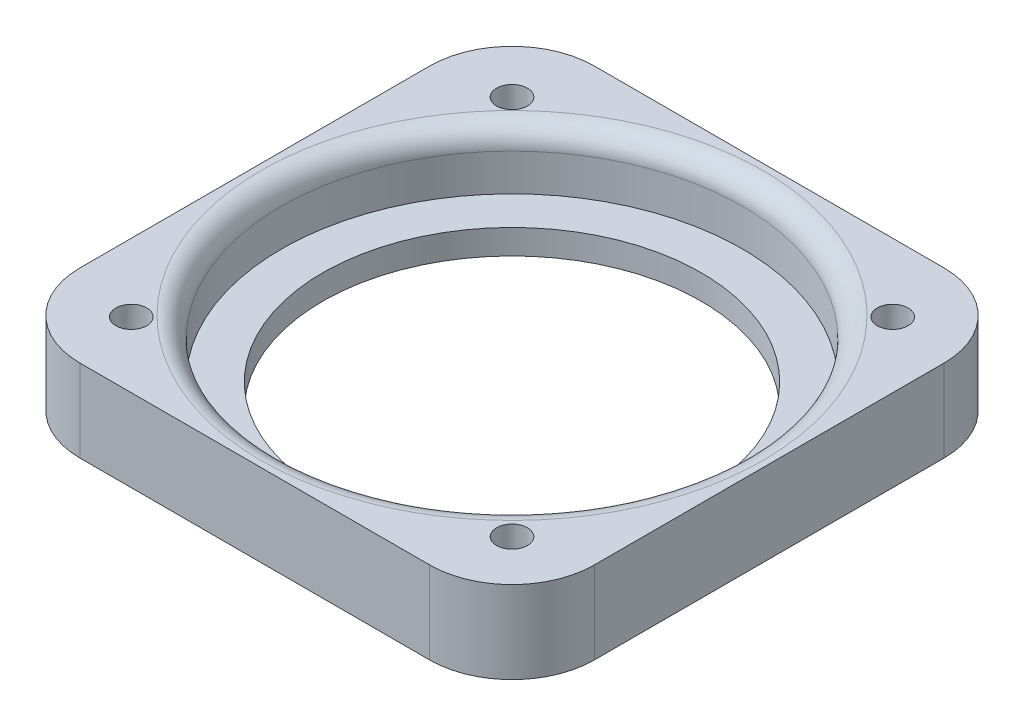
from build123d import *

# Parameters (mm, degrees)
SKETCH_1_R               = 25
EXTRUDE_1_DEPTH          = 8
SKETCH_2_R               = 22.4
CUT_EXTRUDE_1_DEPTH      = 5.6
SKETCH_3_R               = 18.4
CUT_EXTRUDE_2_DEPTH      = 12.5
EXTRUDE_2_DEPTH          = 8
FILLET_1_R               = 8
CUT_EXTRUDE_START        = -15
SKETCH_5_R               = 1.5
CUT_EXTRUDE_3_DEPTH      = 15
FILLET_2_R               = 2
SKETCH_6_R               = 3.5
CUT_EXTRUDE_4_DEPTH      = 2
PATTERN_CIRCULAR_1_COUNT = 4


with BuildPart() as part:
    # 草图1 → 凸台-拉伸1 (new body)
    with BuildSketch(Plane(origin=(0, 0, 0), x_dir=(1, 0, 0), z_dir=(0, 1, 0))):
        with Locations(Location((0, 0, 0), (0, 0, 270))):
            Circle(SKETCH_1_R)
    extrude(amount=EXTRUDE_1_DEPTH)

    # 草图2 → 切除-拉伸1 (cut)
    with BuildSketch(Plane(origin=(0, 8, 0), x_dir=(1, 0, 0), z_dir=(0, 1, 0))):
        with Locations(Location((0, 0, 0), (0, 0, 270))):
            Circle(SKETCH_2_R)
    extrude(amount=-CUT_EXTRUDE_1_DEPTH, mode=Mode.SUBTRACT)

    # 草图3 → 切除-拉伸2 (cut)
    with BuildSketch(Plane(origin=(0, 2.4, 0), x_dir=(1, 0, 0), z_dir=(0, 1, 0))):
        with Locations(Location((0, 0, 0), (0, 0, 270))):
            Circle(SKETCH_3_R)
    extrude(amount=-CUT_EXTRUDE_2_DEPTH, mode=Mode.SUBTRACT)

    # 草图4 → 凸台-拉伸2 (add)
    with BuildSketch(Plane(origin=(0, 0, 0), x_dir=(1, 0, 0), z_dir=(0, 1, 0))):
        with BuildLine():
            Line((0, 25), (-25, 25))
            Line((-25, 25), (-25, 2.6e-08))
            ThreePointArc((-25, 2.6e-08), (-23.301207713, 9.058350794), (-18.435702489, 16.885641052))
            ThreePointArc((-18.435702489, 16.885641052), (-19.445436483, 19.445436483), (-16.885641052, 18.435702489))
            ThreePointArc((-16.885641052, 18.435702489), (-9.058350782, 23.301207718), (0, 25))
        make_face()
        with BuildLine():
            Line((25, 25), (0, 25))
            ThreePointArc((0, 25), (9.210354363, 23.241544108), (17.125028574, 18.213549801))
            ThreePointArc((17.125028574, 18.213549801), (19.682469279, 19.438809921), (18.425448396, 16.896829626))
            ThreePointArc((18.425448396, 16.896829626), (23.298457137, 9.065423048), (25, 0))
            Line((25, 0), (25, 25))
        make_face()
        with BuildLine():
            ThreePointArc((-18.213549801, -17.125028574), (-23.241544113, -9.210354351), (-25, 2.6e-08))
            Line((-25, 2.6e-08), (-25, -25))
            Line((-25, -25), (-5.8e-08, -25))
            ThreePointArc((-5.8e-08, -25), (-9.065423076, -23.298457126), (-16.896829626, -18.425448396))
            ThreePointArc((-16.896829626, -18.425448396), (-19.438809921, -19.682469279), (-18.213549801, -17.125028574))
        make_face()
        with BuildLine():
            Line((25, -25), (25, 0))
            ThreePointArc((25, 0), (23.22561674, -9.250444694), (18.154341838, -17.18778265))
            ThreePointArc((18.154341838, -17.18778265), (19.675883861, -19.675883861), (17.18778265, -18.154341838))
            ThreePointArc((17.18778265, -18.154341838), (9.250444666, -23.225616751), (-5.8e-08, -25))
            Line((-5.8e-08, -25), (25, -25))
        make_face()
    extrude(amount=EXTRUDE_2_DEPTH)

    # 圆角1
    fillet_1_edges = [part.edges().sort_by_distance(p)[0] for p in [
        (-25, 4, -25),
        (25, 4, -25),
        (-25, 4, 25),
        (25, 4, 25),
    ]]
    fillet(fillet_1_edges, radius=FILLET_1_R)

    # 草图5 → 切除-拉伸3 (cut)
    with BuildSketch(Plane(origin=(0, 8, 0), x_dir=(1, 0, 0), z_dir=(0, 1, 0)).offset(CUT_EXTRUDE_START)):
        with Locations(Location((-18.384776311, 18.384776311, 0), (0, 0, 270))):
            Circle(SKETCH_5_R)
        with Locations(Location((18.615223689, 18.384776311, 0), (0, 0, 270))):
            Circle(SKETCH_5_R)
        with Locations(Location((18.615223689, -18.615223689, 0), (0, 0, 270))):
            Circle(SKETCH_5_R)
        with Locations(Location((-18.384776311, -18.615223689, 0), (0, 0, 270))):
            Circle(SKETCH_5_R)
    extrude(amount=CUT_EXTRUDE_3_DEPTH, mode=Mode.SUBTRACT)

    # 圆角2
    fillet_2_edges = [part.edges().sort_by_distance(p)[0] for p in [
        (0, 8, -22.4),
    ]]
    fillet(fillet_2_edges, radius=FILLET_2_R)

    # 草图6 → 切除-拉伸4 (cut)
    with BuildSketch(Plane.XZ):
        with Locations(Location((-18.384776311, 18.615223689, 0), (0, 0, 270))):
            Circle(SKETCH_6_R)
    cut_extrude_4 = extrude(amount=-CUT_EXTRUDE_4_DEPTH, mode=Mode.SUBTRACT)

    # 阵列(圆周)1: 切除-拉伸4 ×4 about axis
    pattern_circular_1_axis = Axis((0, 0, 0), (0, 1, 0))
    for i in range(1, PATTERN_CIRCULAR_1_COUNT):
        add(cut_extrude_4.rotate(pattern_circular_1_axis, i * 360 / PATTERN_CIRCULAR_1_COUNT), mode=Mode.SUBTRACT)


solid = part.part
